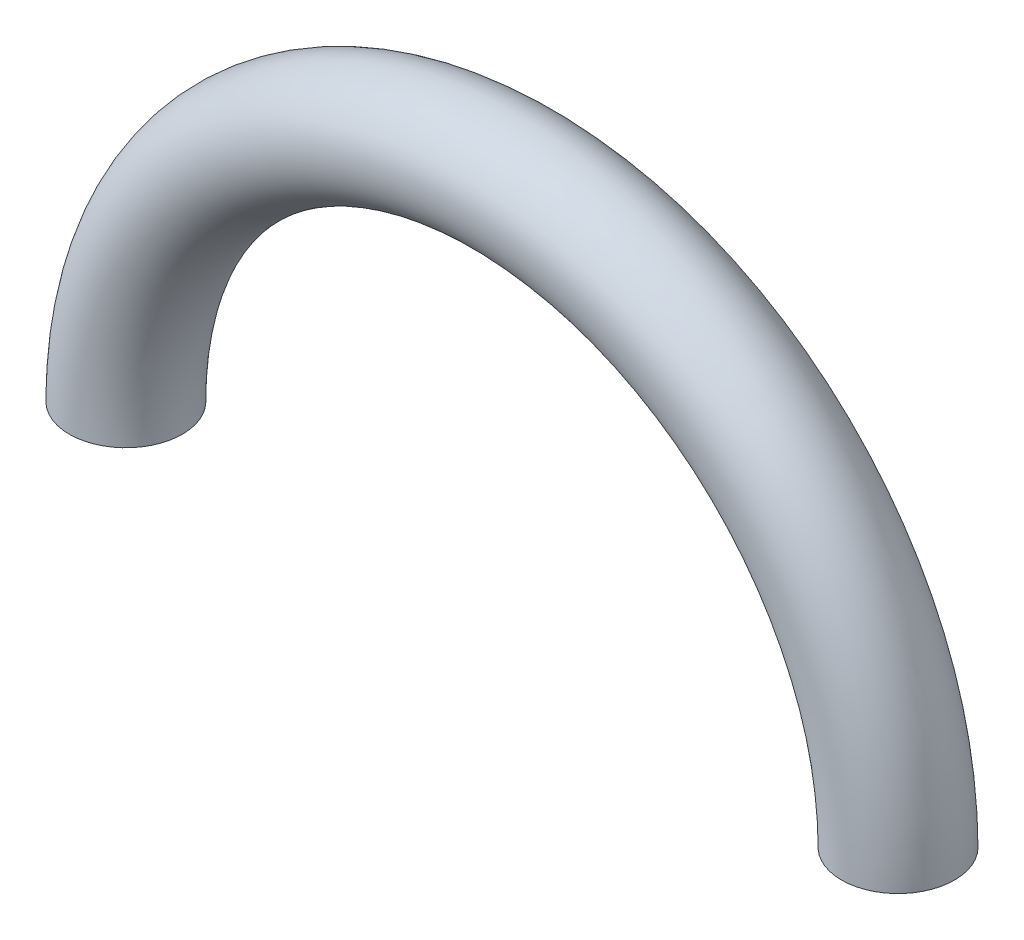
from build123d import *

# Parameters (mm, degrees)
SKETCH7_R = 1.83045086


with BuildPart() as part:
    # Sweep2: sweep along a path in Sketch6
    with BuildLine(Plane.XY) as sweep2_path:
        ThreePointArc((12.499935875, 0), (0, 12.499935875), (-12.499935875, 0))
    # Sketch7 → Sweep2 (sweep)
    with BuildSketch(Plane(origin=(0, 0, 0), x_dir=(1, 0, 0), z_dir=(0, 1, 0))):
        with Locations((12.499935875, 0)):
            Circle(SKETCH7_R)
    sweep(path=sweep2_path.line)


solid = part.part
